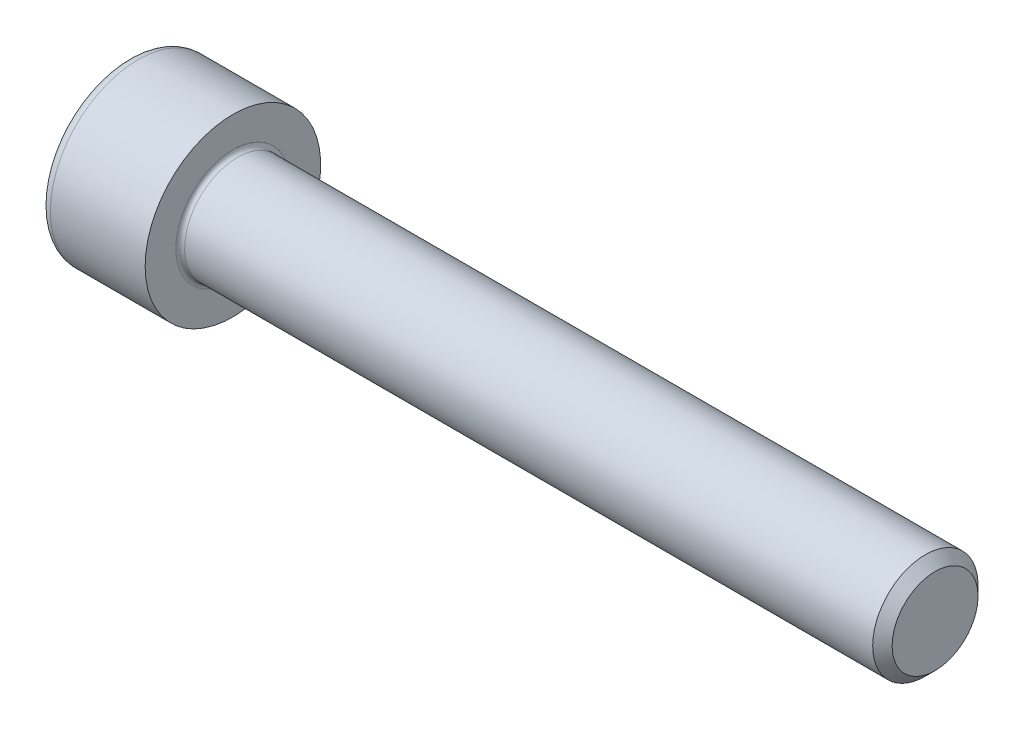
from build123d import *

# Parameters (mm, degrees)
FILLET1_R   = 0.25
FILLET2_R   = 0.6
HEX_2_DEPTH = 3


with BuildPart() as part:
    # BodySke → Base-Revolve (revolve)
    with BuildSketch(Plane.XY, mode=Mode.PRIVATE) as base_revolve_sk:
        Polygon((0, 0), (0, 5), (6, 5), (6, 3), (45.4455, 3), (46, 2.4455), (46, 0), align=None)
    revolve(base_revolve_sk.sketch.rotate(Axis((-31.75, 0, 0), (1, 0, 0)), 90), axis=Axis((-31.75, 0, 0), (1, 0, 0)))

    # Fillet1
    fillet1_edges = [part.edges().sort_by_distance(p)[0] for p in [
        (6, 0, -3),
    ]]
    fillet(fillet1_edges, radius=FILLET1_R)

    # Fillet2
    fillet2_edges = [part.edges().sort_by_distance(p)[0] for p in [
        (0, 0, -5),
    ]]
    fillet(fillet2_edges, radius=FILLET2_R)

    # Sketch2 → Hex-PreBroach (revolve, cut)
    with BuildSketch(Plane.XY, mode=Mode.PRIVATE) as hex_prebroach_sk:
        Polygon((0, 2.51), (3, 2.51), (4.449149176, 0), (0, 0), align=None)
    revolve(hex_prebroach_sk.sketch.rotate(Axis((0, 0, 0), (1, 0, 0)), 90), axis=Axis((0, 0, 0), (1, 0, 0)), mode=Mode.SUBTRACT)

    # Sketch3 → Hex 2 (cut)
    with BuildSketch(Plane(origin=(0, 0, 0), x_dir=(0, 0.500000000000001, 0.866025403784438), z_dir=(-1, 0, 0))):
        Polygon((1.449149176, 2.51), (-1.449149176, 2.51), (-2.898298351, 0), (-1.449149176, -2.51), (1.449149176, -2.51), (2.898298351, 0), align=None)
    extrude(amount=-HEX_2_DEPTH, mode=Mode.SUBTRACT)


solid = part.part
